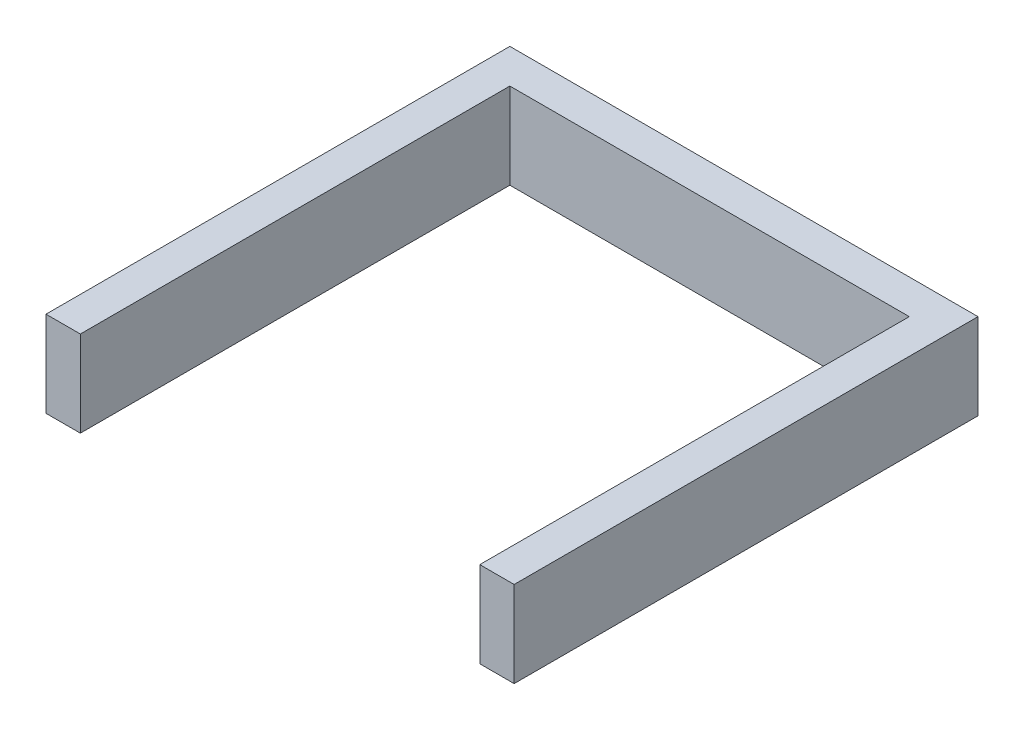
from build123d import *

# Parameters (mm, degrees)
BOSS_EXTRUDE1_DEPTH = 5


with BuildPart() as part:
    # Sketch2 → Boss-Extrude1 (new body)
    with BuildSketch(Plane(origin=(0, 0, 0), x_dir=(1, 0, 0), z_dir=(0, 1, 0))):
        Polygon((-2, 0), (-2, 27), (25.25, 27), (25.25, 0), (23.25, 0), (23.25, 25), (0, 25), (0, 0), align=None)
    extrude(amount=BOSS_EXTRUDE1_DEPTH)


solid = part.part
